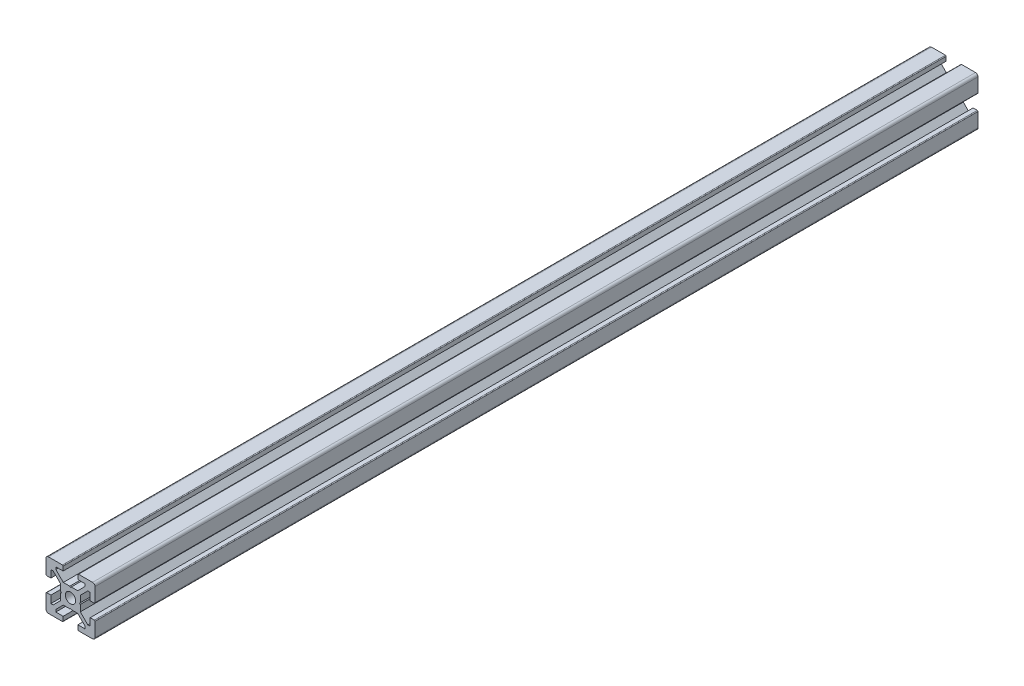
from build123d import *

# Parameters (mm, degrees)
SKETCH1_R           = 2.1
BOSS_EXTRUDE1_DEPTH = 180.2


with BuildPart() as part:
    # Sketch1 → Boss-Extrude1 (new, symmetric)
    with BuildSketch(Plane(origin=(0, 0, 0), x_dir=(-1, 0, 0), z_dir=(0, 0, -1))):
        with BuildLine():
            Line((10, 3.3), (10, 9))
            ThreePointArc((10, 9), (9.707106781, 9.707106781), (9, 10))
            Line((9, 10), (3.3, 10))
            ThreePointArc((3.3, 10), (3.087867966, 9.912132034), (3, 9.7))
            Line((3, 9.7), (3, 8))
            Line((3, 8), (6, 8))
            Line((6, 8), (6, 7.060660172))
            Line((6, 7.060660172), (2.939339828, 4))
            Line((2.939339828, 4), (0.3, 4))
            Line((0.3, 4), (0, 3.7))
            Line((0, 3.7), (-0.3, 4))
            Line((-0.3, 4), (-2.939339828, 4))
            Line((-2.939339828, 4), (-6, 7.060660172))
            Line((-6, 7.060660172), (-6, 8))
            Line((-6, 8), (-3, 8))
            Line((-3, 8), (-3, 9.7))
            ThreePointArc((-3, 9.7), (-3.087867966, 9.912132034), (-3.3, 10))
            Line((-3.3, 10), (-9, 10))
            ThreePointArc((-9, 10), (-9.707106781, 9.707106781), (-10, 9))
            Line((-10, 9), (-10, 3.3))
            ThreePointArc((-10, 3.3), (-9.912132034, 3.087867966), (-9.7, 3))
            Line((-9.7, 3), (-8, 3))
            Line((-8, 3), (-8, 6))
            Line((-8, 6), (-7.060660172, 6))
            Line((-7.060660172, 6), (-4, 2.939339828))
            Line((-4, 2.939339828), (-4, 0.3))
            Line((-4, 0.3), (-3.7, 0))
            Line((-3.7, 0), (-4, -0.3))
            Line((-4, -0.3), (-4, -2.939339828))
            Line((-4, -2.939339828), (-7.060660172, -6))
            Line((-7.060660172, -6), (-8, -6))
            Line((-8, -6), (-8, -3))
            Line((-8, -3), (-9.7, -3))
            ThreePointArc((-9.7, -3), (-9.912132034, -3.087867966), (-10, -3.3))
            Line((-10, -3.3), (-10, -9))
            ThreePointArc((-10, -9), (-9.707106781, -9.707106781), (-9, -10))
            Line((-9, -10), (-3.3, -10))
            ThreePointArc((-3.3, -10), (-3.087867966, -9.912132034), (-3, -9.7))
            Line((-3, -9.7), (-3, -8))
            Line((-3, -8), (-6, -8))
            Line((-6, -8), (-6, -7.060660172))
            Line((-6, -7.060660172), (-2.939339828, -4))
            Line((-2.939339828, -4), (-0.3, -4))
            Line((-0.3, -4), (0, -3.7))
            Line((0, -3.7), (0.3, -4))
            Line((0.3, -4), (2.939339828, -4))
            Line((2.939339828, -4), (6, -7.060660172))
            Line((6, -7.060660172), (6, -8))
            Line((6, -8), (3, -8))
            Line((3, -8), (3, -9.7))
            ThreePointArc((3, -9.7), (3.087867966, -9.912132034), (3.3, -10))
            Line((3.3, -10), (9, -10))
            ThreePointArc((9, -10), (9.707106781, -9.707106781), (10, -9))
            Line((10, -9), (10, -3.3))
            ThreePointArc((10, -3.3), (9.912132034, -3.087867966), (9.7, -3))
            Line((9.7, -3), (8, -3))
            Line((8, -3), (8, -6))
            Line((8, -6), (7.060660172, -6))
            Line((7.060660172, -6), (4, -2.939339828))
            Line((4, -2.939339828), (4, -0.3))
            Line((4, -0.3), (3.7, 0))
            Line((3.7, 0), (4, 0.3))
            Line((4, 0.3), (4, 2.939339828))
            Line((4, 2.939339828), (7.060660172, 6))
            Line((7.060660172, 6), (8, 6))
            Line((8, 6), (8, 3))
            Line((8, 3), (9.7, 3))
            ThreePointArc((9.7, 3), (9.912132034, 3.087867966), (10, 3.3))
        make_face()
        Circle(SKETCH1_R, mode=Mode.SUBTRACT)
    extrude(amount=BOSS_EXTRUDE1_DEPTH, both=True)


solid = part.part
